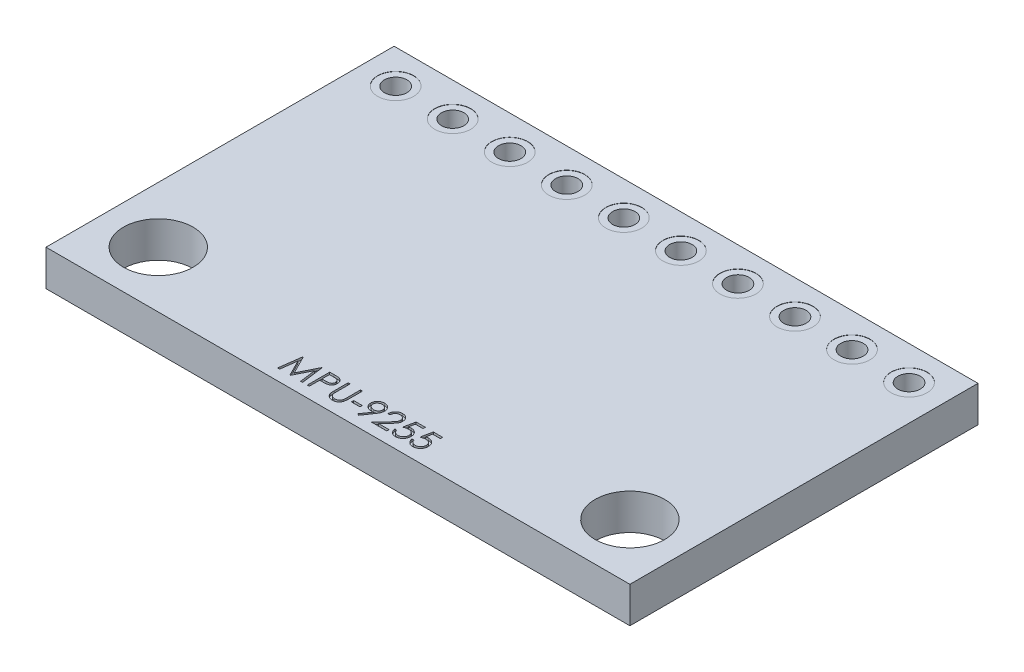
from build123d import *

# Parameters (mm, degrees)
BASES_W                   = 26
BASES_H                   = 15.5
BASE_DEPTH                = 0.8
HOLES_R                   = 0.5
HOLE_DEPTH                = 16.219149122
MOUNTINGHOLES_R           = 1.55
MOUNTINGHOLE_DEPTH        = 16.219149122
SOLDERINGCONNECTIONS_R    = 0.8
SOLDERINGCONNECTIONS_R_2  = 0.5
SOLDERINGCONNECTION_DEPTH = 0.01
SC_LP_COUNT               = 10
SC_LP_PITCH               = 2.54
SC_LP_COPY_1_SKETCH_R     = 0.8
SC_LP_COPY_1_SKETCH_R_2   = 0.5
SC_LP_COPY_1_DEPTH        = 0.01
SC_LP_COPY_2_SKETCH_R     = 0.8
SC_LP_COPY_2_SKETCH_R_2   = 0.5
SC_LP_COPY_2_DEPTH        = 0.01
SC_LP_COPY_3_SKETCH_R     = 0.8
SC_LP_COPY_3_SKETCH_R_2   = 0.5
SC_LP_COPY_3_DEPTH        = 0.01
SC_LP_COPY_4_SKETCH_R     = 0.8
SC_LP_COPY_4_SKETCH_R_2   = 0.5
SC_LP_COPY_4_DEPTH        = 0.01
SC_LP_COPY_5_SKETCH_R     = 0.8
SC_LP_COPY_5_SKETCH_R_2   = 0.5
SC_LP_COPY_5_DEPTH        = 0.01
SC_LP_COPY_6_SKETCH_R     = 0.8
SC_LP_COPY_6_SKETCH_R_2   = 0.5
SC_LP_COPY_6_DEPTH        = 0.01
SC_LP_COPY_7_SKETCH_R     = 0.8
SC_LP_COPY_7_SKETCH_R_2   = 0.5
SC_LP_COPY_7_DEPTH        = 0.01
SC_LP_COPY_8_SKETCH_R     = 0.8
SC_LP_COPY_8_SKETCH_R_2   = 0.5
SC_LP_COPY_8_DEPTH        = 0.01
SC_LP_COPY_9_SKETCH_R     = 0.8
SC_LP_COPY_9_SKETCH_R_2   = 0.5
SC_LP_COPY_9_DEPTH        = 0.01
PNSKETCH_W                = 0.384615384
PNSKETCH_H                = 0.102564103
PN_DEPTH                  = 0.1


with BuildPart() as part:
    # BaseS → Base (new, symmetric)
    with BuildSketch(Plane(origin=(0, 0, 0), x_dir=(1, 0, 0), z_dir=(0, 1, 0))):
        Rectangle(BASES_W, BASES_H)
    extrude(amount=BASE_DEPTH, both=True)

    # HoleS → Hole (cut, through all)
    with BuildSketch(Plane(origin=(0, 0.8, 0), x_dir=(1, 0, 0), z_dir=(0, 1, 0))):
        with Locations(Location((-11.43, 6.25, 0), (0, 0, 270))):
            Circle(HOLES_R)
        with Locations(Location((-8.89, 6.25, 0), (0, 0, 270))):
            Circle(HOLES_R)
        with Locations(Location((-6.35, 6.25, 0), (0, 0, 270))):
            Circle(HOLES_R)
        with Locations(Location((-3.81, 6.25, 0), (0, 0, 270))):
            Circle(HOLES_R)
        with Locations(Location((-1.27, 6.25, 0), (0, 0, 270))):
            Circle(HOLES_R)
        with Locations(Location((1.27, 6.25, 0), (0, 0, 270))):
            Circle(HOLES_R)
        with Locations(Location((3.81, 6.25, 0), (0, 0, 270))):
            Circle(HOLES_R)
        with Locations(Location((6.35, 6.25, 0), (0, 0, 270))):
            Circle(HOLES_R)
        with Locations(Location((8.89, 6.25, 0), (0, 0, 270))):
            Circle(HOLES_R)
        with Locations(Location((11.43, 6.25, 0), (0, 0, 270))):
            Circle(HOLES_R)
    extrude(amount=-HOLE_DEPTH, mode=Mode.SUBTRACT)

    # MountingHoleS → MountingHole (cut, through all)
    with BuildSketch(Plane(origin=(0, 0.8, 0), x_dir=(1, 0, 0), z_dir=(0, 1, 0))):
        with Locations(Location((-10.5, -5.25, 0), (0, 0, 270))):
            Circle(MOUNTINGHOLES_R)
    mountinghole = extrude(amount=-MOUNTINGHOLE_DEPTH, mode=Mode.SUBTRACT)

    # MH HM: MountingHole across plane
    add(mountinghole.mirror(Plane(origin=(0, 0, 0), x_dir=(0, 0, 1), z_dir=(1, 0, 0))), mode=Mode.SUBTRACT)

    # SolderingConnectionS → SolderingConnection (cut)
    with BuildSketch(Plane(origin=(0, 0.8, 0), x_dir=(1, 0, 0), z_dir=(0, 1, 0))):
        with Locations(Location((-11.43, 6.25, 0), (0, 0, 270))):
            Circle(SOLDERINGCONNECTIONS_R)
        with Locations(Location((-11.43, 6.25, 0), (0, 0, 270))):
            Circle(SOLDERINGCONNECTIONS_R_2, mode=Mode.SUBTRACT)
    solderingconnection = extrude(amount=-SOLDERINGCONNECTION_DEPTH, mode=Mode.SUBTRACT)

    # SC VM: SolderingConnection across plane
    add(solderingconnection.mirror(Plane.ZX), mode=Mode.SUBTRACT)

    # SC LP: SolderingConnection ×10
    with Locations(*[(i * SC_LP_PITCH, 0, 0) for i in range(1, SC_LP_COUNT)]):
        add(solderingconnection, mode=Mode.SUBTRACT)

    # SC LP copy 1 sketch → SC LP copy 1 (cut)
    with BuildSketch(Plane(origin=(2.54, -0.8, 0), x_dir=(1, 0, 0), z_dir=(0, -1, 0))):
        with Locations((-11.43, -6.25)):
            Circle(SC_LP_COPY_1_SKETCH_R)
        with Locations((-11.43, -6.25)):
            Circle(SC_LP_COPY_1_SKETCH_R_2, mode=Mode.SUBTRACT)
    extrude(amount=-SC_LP_COPY_1_DEPTH, mode=Mode.SUBTRACT)

    # SC LP copy 2 sketch → SC LP copy 2 (cut)
    with BuildSketch(Plane(origin=(5.08, -0.8, 0), x_dir=(1, 0, 0), z_dir=(0, -1, 0))):
        with Locations((-11.43, -6.25)):
            Circle(SC_LP_COPY_2_SKETCH_R)
        with Locations((-11.43, -6.25)):
            Circle(SC_LP_COPY_2_SKETCH_R_2, mode=Mode.SUBTRACT)
    extrude(amount=-SC_LP_COPY_2_DEPTH, mode=Mode.SUBTRACT)

    # SC LP copy 3 sketch → SC LP copy 3 (cut)
    with BuildSketch(Plane(origin=(7.62, -0.8, 0), x_dir=(1, 0, 0), z_dir=(0, -1, 0))):
        with Locations((-11.43, -6.25)):
            Circle(SC_LP_COPY_3_SKETCH_R)
        with Locations((-11.43, -6.25)):
            Circle(SC_LP_COPY_3_SKETCH_R_2, mode=Mode.SUBTRACT)
    extrude(amount=-SC_LP_COPY_3_DEPTH, mode=Mode.SUBTRACT)

    # SC LP copy 4 sketch → SC LP copy 4 (cut)
    with BuildSketch(Plane(origin=(10.16, -0.8, 0), x_dir=(1, 0, 0), z_dir=(0, -1, 0))):
        with Locations((-11.43, -6.25)):
            Circle(SC_LP_COPY_4_SKETCH_R)
        with Locations((-11.43, -6.25)):
            Circle(SC_LP_COPY_4_SKETCH_R_2, mode=Mode.SUBTRACT)
    extrude(amount=-SC_LP_COPY_4_DEPTH, mode=Mode.SUBTRACT)

    # SC LP copy 5 sketch → SC LP copy 5 (cut)
    with BuildSketch(Plane(origin=(12.7, -0.8, 0), x_dir=(1, 0, 0), z_dir=(0, -1, 0))):
        with Locations((-11.43, -6.25)):
            Circle(SC_LP_COPY_5_SKETCH_R)
        with Locations((-11.43, -6.25)):
            Circle(SC_LP_COPY_5_SKETCH_R_2, mode=Mode.SUBTRACT)
    extrude(amount=-SC_LP_COPY_5_DEPTH, mode=Mode.SUBTRACT)

    # SC LP copy 6 sketch → SC LP copy 6 (cut)
    with BuildSketch(Plane(origin=(15.24, -0.8, 0), x_dir=(1, 0, 0), z_dir=(0, -1, 0))):
        with Locations((-11.43, -6.25)):
            Circle(SC_LP_COPY_6_SKETCH_R)
        with Locations((-11.43, -6.25)):
            Circle(SC_LP_COPY_6_SKETCH_R_2, mode=Mode.SUBTRACT)
    extrude(amount=-SC_LP_COPY_6_DEPTH, mode=Mode.SUBTRACT)

    # SC LP copy 7 sketch → SC LP copy 7 (cut)
    with BuildSketch(Plane(origin=(17.78, -0.8, 0), x_dir=(1, 0, 0), z_dir=(0, -1, 0))):
        with Locations((-11.43, -6.25)):
            Circle(SC_LP_COPY_7_SKETCH_R)
        with Locations((-11.43, -6.25)):
            Circle(SC_LP_COPY_7_SKETCH_R_2, mode=Mode.SUBTRACT)
    extrude(amount=-SC_LP_COPY_7_DEPTH, mode=Mode.SUBTRACT)

    # SC LP copy 8 sketch → SC LP copy 8 (cut)
    with BuildSketch(Plane(origin=(20.32, -0.8, 0), x_dir=(1, 0, 0), z_dir=(0, -1, 0))):
        with Locations((-11.43, -6.25)):
            Circle(SC_LP_COPY_8_SKETCH_R)
        with Locations((-11.43, -6.25)):
            Circle(SC_LP_COPY_8_SKETCH_R_2, mode=Mode.SUBTRACT)
    extrude(amount=-SC_LP_COPY_8_DEPTH, mode=Mode.SUBTRACT)

    # SC LP copy 9 sketch → SC LP copy 9 (cut)
    with BuildSketch(Plane(origin=(22.86, -0.8, 0), x_dir=(1, 0, 0), z_dir=(0, -1, 0))):
        with Locations((-11.43, -6.25)):
            Circle(SC_LP_COPY_9_SKETCH_R)
        with Locations((-11.43, -6.25)):
            Circle(SC_LP_COPY_9_SKETCH_R_2, mode=Mode.SUBTRACT)
    extrude(amount=-SC_LP_COPY_9_DEPTH, mode=Mode.SUBTRACT)

    # PNSketch → PN (cut)
    # profile 1 of 8: a face of its own
    with BuildSketch(Plane(origin=(0, 0.8, 0), x_dir=(1, 0, 0), z_dir=(0, 1, 0))):
        Polygon((-3.185897436, -7.25), (-3.053886218, -6.25), (-3.041065705, -6.25), (-2.628205128, -7.070512821), (-2.216346154, -6.25), (-2.203325321, -6.25), (-2.070512821, -7.25), (-2.160657051, -7.25), (-2.256410256, -6.530448718), (-2.617387821, -7.25), (-2.637620192, -7.25), (-3, -6.528846154), (-3.095552885, -7.25), align=None)
    # profile 2 of 8: a face of its own
    with BuildSketch(Plane(origin=(0, 0.8, 0), x_dir=(1, 0, 0), z_dir=(0, 1, 0))):
        with BuildLine():
            Line((-1.865384615, -6.25), (-1.669270833, -6.25))
            add(Edge.make_bspline(
                [(-1.669270833, -6.25), (-1.655782003, -6.250014827), (-1.629936805, -6.250043238), (-1.592875361, -6.250904594), (-1.559215437, -6.252055077), (-1.529029614, -6.253649904), (-1.502225015, -6.255534644), (-1.478922929, -6.258178084), (-1.458940199, -6.260938168), (-1.446966927, -6.263744284), (-1.44150641, -6.265024038)],
                knots=[0, 0, 0, 0, 1.415646017, 2.712440637, 3.8905458, 4.950247383, 5.884950622, 6.709939814, 7.411656543, 8, 8, 8, 8], degree=3))
            add(Edge.make_bspline(
                [(-1.44150641, -6.265024038), (-1.434593972, -6.266916024), (-1.420931979, -6.270655413), (-1.401245966, -6.278145048), (-1.382516296, -6.287025667), (-1.364678708, -6.297146793), (-1.347952399, -6.308942668), (-1.332087815, -6.32193513), (-1.317224964, -6.33642415), (-1.303447423, -6.352247219), (-1.290794624, -6.369138707), (-1.279900429, -6.387350773), (-1.270778364, -6.406576859), (-1.262954572, -6.426803594), (-1.257323585, -6.448200829), (-1.253081614, -6.47061989), (-1.250389149, -6.494058373), (-1.250131274, -6.510075478), (-1.25, -6.518229167)],
                knots=[0, 0, 0, 0, 0.999701418, 1.975846123, 2.934577507, 3.890451536, 4.834027766, 5.787354733, 6.749476667, 7.726910423, 8.712836071, 9.690891519, 10.682875813, 11.679750201, 12.712814741, 13.765529915, 14.8625177, 16, 16, 16, 16], degree=3))
            add(Edge.make_bspline(
                [(-1.25, -6.518229167), (-1.250120407, -6.526451389), (-1.250355992, -6.542538721), (-1.253183502, -6.566073804), (-1.256992128, -6.588564772), (-1.262848429, -6.609961758), (-1.270518621, -6.630137692), (-1.27951635, -6.649400902), (-1.290368788, -6.667423665), (-1.302838739, -6.684271413), (-1.316710623, -6.699959959), (-1.331925748, -6.714375615), (-1.348422689, -6.727433997), (-1.366149017, -6.739164381), (-1.385277545, -6.749294747), (-1.40551816, -6.758368262), (-1.427046794, -6.765988565), (-1.441944655, -6.769997154), (-1.449519231, -6.772035256)],
                knots=[0, 0, 0, 0, 1.121902311, 2.195077645, 3.232258892, 4.234102512, 5.217864754, 6.176164875, 7.132989551, 8.084763148, 9.034132444, 9.988522005, 10.94243251, 11.903244335, 12.886203696, 13.894208494, 14.929344452, 16, 16, 16, 16], degree=3))
            add(Edge.make_bspline(
                [(-1.449519231, -6.772035256), (-1.455784183, -6.773367537), (-1.469514191, -6.776287306), (-1.492126397, -6.779546866), (-1.518453651, -6.782329037), (-1.548460016, -6.784415077), (-1.582118561, -6.786200896), (-1.619447491, -6.787620351), (-1.660520085, -6.78840031), (-1.689169012, -6.788440536), (-1.704126603, -6.788461538)],
                knots=[0, 0, 0, 0, 0.601384939, 1.31797006, 2.144135048, 3.087295005, 4.142315834, 5.309527816, 6.595305764, 8, 8, 8, 8], degree=3))
            Line((-1.704126603, -6.788461538), (-1.775641026, -6.788461538))
            Line((-1.775641026, -6.788461538), (-1.775641026, -7.25))
            Line((-1.775641026, -7.25), (-1.865384615, -7.25))
            Line((-1.865384615, -7.25), (-1.865384615, -6.25))
        make_face()
        with BuildLine():
            Line((-1.775641026, -6.352564103), (-1.775641026, -6.685897436))
            Line((-1.775641026, -6.685897436), (-1.600560897, -6.688100962))
            add(Edge.make_bspline(
                [(-1.600560897, -6.688100962), (-1.592012347, -6.68810538), (-1.575509547, -6.688113909), (-1.551670626, -6.686975274), (-1.529553687, -6.685660836), (-1.509226666, -6.683736286), (-1.490680399, -6.681015927), (-1.473883962, -6.678269716), (-1.458967595, -6.674296755), (-1.44151068, -6.668947307), (-1.422058295, -6.659823702), (-1.400896139, -6.646580877), (-1.382961685, -6.629700674), (-1.367442172, -6.610721294), (-1.355126207, -6.589607257), (-1.346110209, -6.567016132), (-1.340812736, -6.543179604), (-1.340102395, -6.526868707), (-1.33974359, -6.518629808)],
                knots=[0, 0, 0, 0, 1.160613943, 2.240541288, 3.23993089, 4.169200891, 5.011653406, 5.7853311, 6.478053781, 7.106038997, 8.262395093, 9.384106736, 10.481365981, 11.59014053, 12.70357646, 13.786202915, 14.881775077, 16, 16, 16, 16], degree=3))
            add(Edge.make_bspline(
                [(-1.33974359, -6.518629808), (-1.340104346, -6.510590232), (-1.340821484, -6.494608552), (-1.346151731, -6.471186049), (-1.355108678, -6.44883299), (-1.367524848, -6.427983537), (-1.382593742, -6.409072451), (-1.40010784, -6.3926447), (-1.420025915, -6.379438499), (-1.438553981, -6.370914704), (-1.455011462, -6.36571034), (-1.469306308, -6.362068957), (-1.485446501, -6.359161641), (-1.503437295, -6.356807497), (-1.523139248, -6.354792223), (-1.544721623, -6.353424801), (-1.568102664, -6.352624385), (-1.584334256, -6.352584683), (-1.592748397, -6.352564103)],
                knots=[0, 0, 0, 0, 1.120700087, 2.227813068, 3.331159281, 4.466773991, 5.599788987, 6.693661531, 7.80175334, 8.91857717, 9.525282508, 10.207424825, 10.974604443, 11.810962634, 12.737642355, 13.736264703, 14.826523623, 16, 16, 16, 16], degree=3))
            Line((-1.592748397, -6.352564103), (-1.775641026, -6.352564103))
        make_face(mode=Mode.SUBTRACT)
    # profile 3 of 8: a face of its own
    with BuildSketch(Plane(origin=(0, 0.8, 0), x_dir=(1, 0, 0), z_dir=(0, 1, 0))):
        with BuildLine():
            Line((-1.044871795, -6.25), (-0.955128205, -6.25))
            Line((-0.955128205, -6.25), (-0.955128205, -6.849158654))
            add(Edge.make_bspline(
                [(-0.955128205, -6.849158654), (-0.955141561, -6.857638864), (-0.955166905, -6.873731524), (-0.954997615, -6.896636753), (-0.95452351, -6.917000313), (-0.954224607, -6.934900698), (-0.953559655, -6.950255769), (-0.953017356, -6.963148714), (-0.952320054, -6.973518487), (-0.95148202, -6.97957018), (-0.951121795, -6.982171474)],
                knots=[0, 0, 0, 0, 1.528628734, 2.90083645, 4.128790002, 5.200304208, 6.127813768, 6.898992206, 7.526736466, 8, 8, 8, 8], degree=3))
            add(Edge.make_bspline(
                [(-0.951121795, -6.982171474), (-0.949642521, -6.991556264), (-0.946767325, -7.009797044), (-0.939439788, -7.035770838), (-0.929206217, -7.059179827), (-0.917079633, -7.080754481), (-0.901098887, -7.099894298), (-0.88195502, -7.117526199), (-0.858761371, -7.132946715), (-0.832972627, -7.147046947), (-0.805176845, -7.158379827), (-0.776773626, -7.16694936), (-0.748189918, -7.172171903), (-0.72905387, -7.172776628), (-0.719551282, -7.173076923)],
                knots=[0, 0, 0, 0, 1.035780045, 2.013197591, 2.933192213, 3.817615948, 4.702609284, 5.640816605, 6.646850145, 7.73207398, 8.84249596, 9.914020372, 10.964143139, 12, 12, 12, 12], degree=3))
            add(Edge.make_bspline(
                [(-0.719551282, -7.173076923), (-0.711393071, -7.172770109), (-0.695123767, -7.172158252), (-0.670950501, -7.168369272), (-0.647407613, -7.161540539), (-0.624378847, -7.152729179), (-0.602792852, -7.14108701), (-0.582637583, -7.127638199), (-0.564647887, -7.111863663), (-0.548231316, -7.094406422), (-0.53393562, -7.074709336), (-0.521543866, -7.053201297), (-0.5113936, -7.029558626), (-0.506381164, -7.012943077), (-0.50380609, -7.004407051)],
                knots=[0, 0, 0, 0, 0.994687771, 1.983630487, 2.973142513, 3.978332533, 4.983357753, 5.956394766, 6.925816176, 7.893390482, 8.871859704, 9.88551698, 10.913711441, 12, 12, 12, 12], degree=3))
            add(Edge.make_bspline(
                [(-0.50380609, -7.004407051), (-0.502948911, -7.000878887), (-0.501038772, -6.993016716), (-0.499253902, -6.979724918), (-0.497394894, -6.964042243), (-0.496105017, -6.945856011), (-0.494847526, -6.925227161), (-0.494095219, -6.902048231), (-0.493747495, -6.876403385), (-0.493643872, -6.858507053), (-0.493589744, -6.849158654)],
                knots=[0, 0, 0, 0, 0.558680831, 1.244966039, 2.062412453, 2.990489873, 4.051219941, 5.244515665, 6.560634259, 8, 8, 8, 8], degree=3))
            Line((-0.493589744, -6.849158654), (-0.493589744, -6.25))
            Line((-0.493589744, -6.25), (-0.403846154, -6.25))
            Line((-0.403846154, -6.25), (-0.403846154, -6.853966346))
            add(Edge.make_bspline(
                [(-0.403846154, -6.853966346), (-0.40391876, -6.864851597), (-0.404060454, -6.886094827), (-0.40528919, -6.917223786), (-0.407248333, -6.94675321), (-0.410016358, -6.974687066), (-0.413684074, -7.000925397), (-0.417762708, -7.025698188), (-0.42295686, -7.048827614), (-0.429023546, -7.070494019), (-0.435958846, -7.091118452), (-0.444942031, -7.110692342), (-0.455063317, -7.129810742), (-0.467067503, -7.148184487), (-0.48055647, -7.165894931), (-0.495828379, -7.182834666), (-0.512378139, -7.199274394), (-0.53048087, -7.214792413), (-0.549838163, -7.229023463), (-0.570392437, -7.241537112), (-0.591985799, -7.252115289), (-0.614562121, -7.260822696), (-0.638131036, -7.267369724), (-0.662693139, -7.27224834), (-0.688304337, -7.275020425), (-0.70572281, -7.275432405), (-0.714543269, -7.275641026)],
                knots=[0, 0, 0, 0, 1.316592851, 2.569410997, 3.76748051, 4.895814652, 5.963796859, 6.97159953, 7.931736103, 8.829262218, 9.692595152, 10.560224239, 11.431080259, 12.30701507, 13.211635791, 14.121146779, 15.063487852, 16.031507147, 17.00238618, 17.966455255, 18.938106653, 19.907068911, 20.888905087, 21.893141452, 22.933117798, 24, 24, 24, 24], degree=3))
            add(Edge.make_bspline(
                [(-0.714543269, -7.275641026), (-0.724163013, -7.275416807), (-0.743036915, -7.274976891), (-0.770847792, -7.272456105), (-0.797508991, -7.267707992), (-0.823302098, -7.261662294), (-0.847875955, -7.253324084), (-0.871559796, -7.243581762), (-0.893947991, -7.231616831), (-0.915403742, -7.218304433), (-0.935353672, -7.203325965), (-0.953667216, -7.187000201), (-0.970374607, -7.169588664), (-0.985194235, -7.150902845), (-0.99837163, -7.131088072), (-1.00972312, -7.110088289), (-1.019469761, -7.087911627), (-1.024500209, -7.072496427), (-1.027043269, -7.064703526)],
                knots=[0, 0, 0, 0, 1.13879206, 2.234305948, 3.301075583, 4.341971843, 5.366689343, 6.369221514, 7.369726634, 8.367512178, 9.355451585, 10.318319045, 11.268648973, 12.207971039, 13.137398894, 14.081662264, 15.030215811, 16, 16, 16, 16], degree=3))
            add(Edge.make_bspline(
                [(-1.027043269, -7.064703526), (-1.028522457, -7.059379933), (-1.031730849, -7.047832942), (-1.035166648, -7.028722517), (-1.038054957, -7.006718254), (-1.040770831, -6.981818649), (-1.042373391, -6.954004401), (-1.043778373, -6.923287568), (-1.044881693, -6.889631008), (-1.044875186, -6.866186861), (-1.044871795, -6.853966346)],
                knots=[0, 0, 0, 0, 0.625038921, 1.35572334, 2.194682327, 3.136881307, 4.189498639, 5.346923369, 6.617055217, 8, 8, 8, 8], degree=3))
            Line((-1.044871795, -6.853966346), (-1.044871795, -6.25))
        make_face()
    # profile 4 of 8: a face of its own
    with BuildSketch(Plane(origin=(0, 0.8, 0), x_dir=(1, 0, 0), z_dir=(0, 1, 0))):
        with Locations((-0.044871795, -6.865384616)):
            Rectangle(PNSKETCH_W, PNSKETCH_H)
    # profile 5 of 8: a face of its own
    with BuildSketch(Plane(origin=(0, 0.8, 0), x_dir=(1, 0, 0), z_dir=(0, 1, 0))):
        with BuildLine():
            Line((0.442307692, -7.275641026), (0.370592949, -7.225761218))
            Line((0.370592949, -7.225761218), (0.648637821, -6.819310897))
            add(Edge.make_bspline(
                [(0.648637821, -6.819310897), (0.63089761, -6.821480344), (0.595966147, -6.825752106), (0.560784118, -6.826536864), (0.543469551, -6.826923077)],
                knots=[0, 0, 0, 0, 1.015715272, 2, 2, 2, 2], degree=3))
            add(Edge.make_bspline(
                [(0.543469551, -6.826923077), (0.532971823, -6.826654198), (0.512365701, -6.826126412), (0.482070944, -6.821943038), (0.452960783, -6.815500145), (0.425112396, -6.805886215), (0.398421109, -6.793938155), (0.372945191, -6.779121865), (0.348718936, -6.761691496), (0.326002533, -6.741739213), (0.305342037, -6.719831198), (0.28693538, -6.696643871), (0.271637914, -6.67190788), (0.258930318, -6.646127817), (0.249293046, -6.618933145), (0.242275178, -6.590633317), (0.237954505, -6.56102999), (0.237440478, -6.540879953), (0.237179487, -6.530649038)],
                knots=[0, 0, 0, 0, 1.060718605, 2.082097864, 3.085795603, 4.069760067, 5.054557537, 6.03741023, 7.043284206, 8.066802108, 9.088538119, 10.083643548, 11.053783639, 12.022749082, 12.983451788, 13.964007469, 14.966251758, 16, 16, 16, 16], degree=3))
            add(Edge.make_bspline(
                [(0.237179487, -6.530649038), (0.23767504, -6.516657995), (0.23864771, -6.489196414), (0.246475857, -6.44907248), (0.25935024, -6.411133468), (0.277301205, -6.375479127), (0.299911125, -6.342622344), (0.327085008, -6.313019884), (0.358657569, -6.287092783), (0.393909575, -6.264805904), (0.432010438, -6.246881619), (0.471915769, -6.23367039), (0.513319803, -6.22589932), (0.541367709, -6.224874788), (0.555488782, -6.224358974)],
                knots=[0, 0, 0, 0, 1.022988612, 2.007919123, 2.978103895, 3.94594894, 4.918897164, 5.887013414, 6.875921846, 7.89917871, 8.930658928, 9.948724884, 10.967259574, 12, 12, 12, 12], degree=3))
            add(Edge.make_bspline(
                [(0.555488782, -6.224358974), (0.569342616, -6.224881878), (0.596716487, -6.225915087), (0.636970489, -6.233481935), (0.675525065, -6.24623527), (0.71216649, -6.263859431), (0.746092036, -6.285951119), (0.776599411, -6.312275269), (0.802992422, -6.342848276), (0.825227816, -6.376930702), (0.843076399, -6.41354984), (0.855954194, -6.451773817), (0.86388152, -6.491327738), (0.86488047, -6.518126159), (0.865384615, -6.531650641)],
                knots=[0, 0, 0, 0, 1.026385292, 2.028040595, 3.023318987, 4.028184125, 5.03290303, 6.015178782, 7.004435299, 8.016004309, 9.023023918, 10.015172535, 10.998308025, 12, 12, 12, 12], degree=3))
            add(Edge.make_bspline(
                [(0.865384615, -6.531650641), (0.865047927, -6.54214886), (0.864365039, -6.563441872), (0.859583237, -6.595793398), (0.851463184, -6.628779464), (0.842248413, -6.65669992), (0.833353508, -6.679759477), (0.824981756, -6.697974214), (0.81569257, -6.717146004), (0.804858637, -6.737073814), (0.793212266, -6.758011682), (0.780052473, -6.7797496), (0.765679452, -6.802316741), (0.755442389, -6.817530195), (0.750200321, -6.825320513)],
                knots=[0, 0, 0, 0, 1.179839688, 2.393009684, 3.667231171, 4.993948276, 5.694988576, 6.444077775, 7.246288328, 8.089075292, 8.993003841, 9.939041771, 10.944649915, 12, 12, 12, 12], degree=3))
            Line((0.750200321, -6.825320513), (0.442307692, -7.275641026))
        make_face()
        with BuildLine():
            add(Edge.make_bspline(
                [(0.560096154, -6.724358974), (0.568048729, -6.724141722), (0.58352969, -6.723718805), (0.606208918, -6.721144736), (0.627615834, -6.71658074), (0.647807619, -6.710032251), (0.666986734, -6.702130345), (0.684848542, -6.692069778), (0.701407992, -6.680065025), (0.716775971, -6.666576449), (0.730422828, -6.651590568), (0.74257798, -6.635905681), (0.752909571, -6.619452935), (0.761070507, -6.602026288), (0.767780386, -6.584049943), (0.772414103, -6.565234413), (0.774981056, -6.545677727), (0.775418649, -6.532392396), (0.775641026, -6.525641026)],
                knots=[0, 0, 0, 0, 1.163407946, 2.26475976, 3.333800367, 4.359385343, 5.366239384, 6.363380779, 7.350133999, 8.353570782, 9.349036268, 10.310270964, 11.253520213, 12.184142, 13.120487599, 14.056272588, 15.012232024, 16, 16, 16, 16], degree=3))
            add(Edge.make_bspline(
                [(0.775641026, -6.525641026), (0.775449692, -6.518886836), (0.775072644, -6.505576876), (0.772047702, -6.485991236), (0.766726209, -6.467221733), (0.759586071, -6.44916561), (0.750180289, -6.431971218), (0.738893578, -6.415422683), (0.725484307, -6.399624932), (0.710055002, -6.384949508), (0.693416559, -6.371421537), (0.675684987, -6.359482658), (0.65700644, -6.349476602), (0.637494871, -6.341219754), (0.617109629, -6.334776389), (0.595862775, -6.330142856), (0.573646945, -6.327579498), (0.558566577, -6.327144671), (0.55088141, -6.326923077)],
                knots=[0, 0, 0, 0, 0.972161553, 1.915763587, 2.844109794, 3.775983486, 4.705125789, 5.659731448, 6.655561913, 7.682237399, 8.721216875, 9.739758359, 10.754845918, 11.767244016, 12.7857855, 13.828538656, 14.893392813, 16, 16, 16, 16], degree=3))
            add(Edge.make_bspline(
                [(0.55088141, -6.326923077), (0.543263081, -6.327145029), (0.528315981, -6.327580497), (0.50629765, -6.330137984), (0.485194459, -6.334807551), (0.464868282, -6.341216769), (0.445357293, -6.349477218), (0.426679626, -6.359483182), (0.408943907, -6.371418789), (0.392321416, -6.384960152), (0.376864867, -6.399556623), (0.363686144, -6.415491888), (0.352373603, -6.431962609), (0.342980745, -6.449167897), (0.335837169, -6.467221122), (0.330516597, -6.485991401), (0.327491407, -6.505576832), (0.327114394, -6.518886821), (0.326923077, -6.525641026)],
                knots=[0, 0, 0, 0, 1.099389452, 2.15699305, 3.192601482, 4.213358962, 5.227959689, 6.245255729, 7.266013209, 8.307253147, 9.336162325, 10.327954924, 11.284637477, 12.215801273, 13.149702402, 14.080068371, 15.025723358, 16, 16, 16, 16], degree=3))
            add(Edge.make_bspline(
                [(0.326923077, -6.525641026), (0.327096199, -6.532397654), (0.327437626, -6.545722961), (0.330731281, -6.565301931), (0.336239361, -6.584069986), (0.343616329, -6.602209617), (0.353331069, -6.619544433), (0.365252169, -6.635992251), (0.379225182, -6.651739523), (0.395063321, -6.666541583), (0.412397082, -6.680127919), (0.430910438, -6.691993742), (0.450284677, -6.702014441), (0.470588, -6.710054836), (0.491669943, -6.716515311), (0.51371998, -6.721136324), (0.536665191, -6.723694115), (0.5522109, -6.724135228), (0.560096154, -6.724358974)],
                knots=[0, 0, 0, 0, 0.952633368, 1.87876736, 2.791047057, 3.707742249, 4.635551637, 5.587206343, 6.568248508, 7.601284464, 8.641511608, 9.671105535, 10.699146789, 11.713763218, 12.747829548, 13.806491675, 14.887386225, 16, 16, 16, 16], degree=3))
        make_face(mode=Mode.SUBTRACT)
    # profile 6 of 8: a face of its own
    with BuildSketch(Plane(origin=(0, 0.8, 0), x_dir=(1, 0, 0), z_dir=(0, 1, 0))):
        with BuildLine():
            Line((1.121794872, -6.557692308), (1.032051282, -6.557692308))
            add(Edge.make_bspline(
                [(1.032051282, -6.557692308), (1.032636183, -6.54578634), (1.033784913, -6.522403336), (1.039164424, -6.488310791), (1.046861817, -6.455723706), (1.05774509, -6.42490373), (1.071261169, -6.395578357), (1.087469749, -6.367864066), (1.106667992, -6.341866584), (1.128441344, -6.317826914), (1.152089527, -6.295773323), (1.177605509, -6.276728968), (1.204418374, -6.260638204), (1.232446774, -6.247186421), (1.262006935, -6.237089322), (1.292830609, -6.229597425), (1.325053219, -6.225089898), (1.347007511, -6.224605388), (1.358173077, -6.224358974)],
                knots=[0, 0, 0, 0, 1.10065271, 2.161652631, 3.183658789, 4.190468796, 5.17591951, 6.163126047, 7.15150782, 8.156236427, 9.156009102, 10.134482811, 11.092018607, 12.041330605, 13.001268258, 13.972401359, 14.968799086, 16, 16, 16, 16], degree=3))
            add(Edge.make_bspline(
                [(1.358173077, -6.224358974), (1.369138241, -6.224615676), (1.390684397, -6.225120086), (1.422130686, -6.229451809), (1.452067056, -6.236236264), (1.48043499, -6.245754954), (1.507008151, -6.258550505), (1.531986164, -6.27392123), (1.555666395, -6.291698325), (1.576982619, -6.312627986), (1.596556356, -6.334971524), (1.613442715, -6.358825211), (1.627903619, -6.38346215), (1.639957241, -6.409070207), (1.648830424, -6.435890501), (1.655567055, -6.463532559), (1.659374887, -6.492282505), (1.659959294, -6.511741521), (1.66025641, -6.521634615)],
                knots=[0, 0, 0, 0, 1.111607364, 2.184268762, 3.212621178, 4.221274766, 5.211760367, 6.196651075, 7.1921475, 8.207485113, 9.220403448, 10.201281604, 11.166441695, 12.114753415, 13.065576456, 14.026450734, 14.996634279, 16, 16, 16, 16], degree=3))
            add(Edge.make_bspline(
                [(1.66025641, -6.521634615), (1.659772621, -6.535562568), (1.658813532, -6.563174058), (1.650609424, -6.603749733), (1.637796135, -6.643062138), (1.622368319, -6.674701367), (1.606804764, -6.700196651), (1.592779762, -6.72118771), (1.576361244, -6.743789272), (1.557310245, -6.767925654), (1.536020853, -6.793785913), (1.512300235, -6.821354426), (1.48597924, -6.85034636), (1.467505382, -6.870147961), (1.457932692, -6.880408654)],
                knots=[0, 0, 0, 0, 1.184426356, 2.348067706, 3.509069118, 4.696110526, 5.333549288, 6.050745305, 6.844228056, 7.710549037, 8.667450064, 9.695053472, 10.805634456, 12, 12, 12, 12], degree=3))
            Line((1.457932692, -6.880408654), (1.207732372, -7.147435897))
            Line((1.207732372, -7.147435897), (1.673076923, -7.147435897))
            Line((1.673076923, -7.147435897), (1.673076923, -7.25))
            Line((1.673076923, -7.25), (0.993589744, -7.25))
            Line((0.993589744, -7.25), (1.381410256, -6.836137821))
            add(Edge.make_bspline(
                [(1.381410256, -6.836137821), (1.39085251, -6.826281161), (1.408989146, -6.807348537), (1.434641311, -6.779707691), (1.457681022, -6.754064965), (1.47825742, -6.730468808), (1.495924136, -6.708574075), (1.511601916, -6.689089874), (1.524163514, -6.671160031), (1.537796484, -6.650376998), (1.551000478, -6.62500205), (1.562346866, -6.593992425), (1.569265394, -6.562070353), (1.570095347, -6.540498342), (1.570512821, -6.529647436)],
                knots=[0, 0, 0, 0, 1.329631726, 2.553950428, 3.673215718, 4.687767853, 5.603093632, 6.413772471, 7.123043292, 7.734684054, 8.834405432, 9.900288307, 10.943827018, 12, 12, 12, 12], degree=3))
            add(Edge.make_bspline(
                [(1.570512821, -6.529647436), (1.57033118, -6.522824179), (1.569973201, -6.509376851), (1.566813859, -6.489660919), (1.562039429, -6.470642401), (1.555197926, -6.452262796), (1.546167429, -6.434706895), (1.535175035, -6.417953329), (1.52249216, -6.401756482), (1.507820368, -6.386569826), (1.491702791, -6.37266091), (1.474675863, -6.360339742), (1.456661547, -6.350042854), (1.437735798, -6.341601854), (1.417951378, -6.334980317), (1.397270023, -6.330392151), (1.375748875, -6.327511442), (1.361053591, -6.327121678), (1.353565705, -6.326923077)],
                knots=[0, 0, 0, 0, 0.991446411, 1.95395049, 2.89581595, 3.838931463, 4.798493298, 5.75982156, 6.748411868, 7.785213223, 8.824556874, 9.840280684, 10.836137867, 11.835679398, 12.848801643, 13.863922112, 14.911575587, 16, 16, 16, 16], degree=3))
            add(Edge.make_bspline(
                [(1.353565705, -6.326923077), (1.345745467, -6.327127372), (1.330387811, -6.327528573), (1.307839516, -6.330335049), (1.286329294, -6.335176717), (1.265803036, -6.341798624), (1.246226011, -6.350215353), (1.227693427, -6.360698708), (1.210246888, -6.373208278), (1.193853595, -6.387391294), (1.178749601, -6.403182037), (1.165479065, -6.420784884), (1.153883633, -6.439878431), (1.143766709, -6.46041116), (1.135550797, -6.482569383), (1.129272754, -6.506274441), (1.124305084, -6.531423407), (1.122645506, -6.548790574), (1.121794872, -6.557692308)],
                knots=[0, 0, 0, 0, 1.031018746, 2.02475058, 2.990194455, 3.934040569, 4.864654155, 5.795059489, 6.735614925, 7.690564532, 8.649604399, 9.611025574, 10.590972636, 11.591080095, 12.624614302, 13.701020113, 14.821632451, 16, 16, 16, 16], degree=3))
        make_face()
    # profile 7 of 8: a face of its own
    with BuildSketch(Plane(origin=(0, 0.8, 0), x_dir=(1, 0, 0), z_dir=(0, 1, 0))):
        with BuildLine():
            Line((2.391025641, -6.25), (2.391025641, -6.352564103))
            Line((2.391025641, -6.352564103), (2.05088141, -6.352564103))
            Line((2.05088141, -6.352564103), (1.996995192, -6.615584936))
            add(Edge.make_bspline(
                [(1.996995192, -6.615584936), (2.007582585, -6.612662001), (2.028093984, -6.606999277), (2.05836823, -6.600711914), (2.087108859, -6.596921787), (2.105758965, -6.59640427), (2.114783654, -6.596153846)],
                knots=[0, 0, 0, 0, 1.100273476, 2.13160584, 3.095893838, 4, 4, 4, 4], degree=3))
            add(Edge.make_bspline(
                [(2.114783654, -6.596153846), (2.125950437, -6.596395542), (2.147907122, -6.596870777), (2.180032535, -6.601434162), (2.210699076, -6.608616995), (2.23984261, -6.61865143), (2.267517053, -6.631482782), (2.293467785, -6.647511336), (2.318084332, -6.666235145), (2.340925073, -6.687762292), (2.361646304, -6.711454182), (2.379865158, -6.73692786), (2.395340184, -6.763935763), (2.407786114, -6.792735937), (2.417724495, -6.823009981), (2.424339351, -6.855076433), (2.428744125, -6.888633039), (2.429236235, -6.911577202), (2.429487179, -6.923277244)],
                knots=[0, 0, 0, 0, 1.052922333, 2.070308379, 3.05430497, 4.020497103, 4.973039431, 5.925935799, 6.892292201, 7.88610001, 8.88166317, 9.857072816, 10.836096531, 11.812156883, 12.81219415, 13.836441305, 14.89672472, 16, 16, 16, 16], degree=3))
            add(Edge.make_bspline(
                [(2.429487179, -6.923277244), (2.429297158, -6.931426449), (2.428919683, -6.947614732), (2.427000086, -6.971655932), (2.423304168, -6.99518817), (2.418341961, -7.018214567), (2.41190127, -7.040691531), (2.404104397, -7.062683396), (2.394562675, -7.084053284), (2.384096568, -7.105003397), (2.37231186, -7.125060113), (2.359232286, -7.143816966), (2.345413575, -7.161555332), (2.330544607, -7.17808497), (2.31448718, -7.193297261), (2.297435761, -7.207282484), (2.279526413, -7.22027715), (2.260482058, -7.231753777), (2.240727063, -7.242314622), (2.219976144, -7.25097849), (2.198701658, -7.258724355), (2.176597408, -7.264898506), (2.153713461, -7.269736379), (2.130012097, -7.273022264), (2.105617619, -7.275415532), (2.089081902, -7.275565349), (2.080729167, -7.275641026)],
                knots=[0, 0, 0, 0, 1.056347294, 2.098418968, 3.122841568, 4.141288669, 5.149314143, 6.15115421, 7.162517403, 8.180376062, 9.185164535, 10.17417709, 11.141909838, 12.097768115, 13.052685741, 14.0056014, 14.954263652, 15.917497458, 16.885230207, 17.854509472, 18.828990115, 19.81800267, 20.826176721, 21.857883937, 22.917946725, 24, 24, 24, 24], degree=3))
            add(Edge.make_bspline(
                [(2.080729167, -7.275641026), (2.070765115, -7.275443643), (2.051162021, -7.275055317), (2.022441859, -7.270992893), (1.994809114, -7.265174631), (1.968486228, -7.256421411), (1.943237296, -7.245453612), (1.919402233, -7.231591849), (1.896372012, -7.215883534), (1.875082858, -7.19734629), (1.855323969, -7.177084667), (1.837636395, -7.155096769), (1.821883944, -7.1317455), (1.808318874, -7.106917456), (1.79674801, -7.080677876), (1.787658014, -7.052928447), (1.780321341, -7.02381416), (1.777217506, -7.0037703), (1.775641026, -6.993589744)],
                knots=[0, 0, 0, 0, 1.0467383, 2.05933395, 3.04377827, 4.011590433, 4.970194871, 5.932262533, 6.905835911, 7.896367577, 8.894135286, 9.877477877, 10.858688626, 11.851381753, 12.8477658, 13.868841284, 14.917554742, 16, 16, 16, 16], degree=3))
            Line((1.775641026, -6.993589744), (1.865384615, -6.993589744))
            add(Edge.make_bspline(
                [(1.865384615, -6.993589744), (1.867592775, -7.003125873), (1.871836979, -7.021454843), (1.881152908, -7.047206655), (1.892543158, -7.070155004), (1.906087257, -7.090603457), (1.922244409, -7.108434599), (1.940681388, -7.124325188), (1.961352167, -7.138660939), (1.984321661, -7.150610301), (2.008553969, -7.160801374), (2.033916029, -7.167587572), (2.059717271, -7.172359256), (2.077168234, -7.172836902), (2.0859375, -7.173076923)],
                knots=[0, 0, 0, 0, 1.136247022, 2.183929868, 3.172523383, 4.106158343, 5.02341133, 5.958108904, 6.928429099, 7.938127109, 8.96079061, 9.975095812, 10.982467395, 12, 12, 12, 12], degree=3))
            add(Edge.make_bspline(
                [(2.0859375, -7.173076923), (2.094497056, -7.172842415), (2.11135089, -7.172380667), (2.136154144, -7.168826664), (2.160100679, -7.163353072), (2.18295421, -7.155161685), (2.20511465, -7.145206051), (2.226021441, -7.132430315), (2.246279406, -7.117727452), (2.265258873, -7.100882701), (2.282641573, -7.082319931), (2.298000464, -7.062469247), (2.310793868, -7.041293005), (2.321575042, -7.019157819), (2.329761699, -6.995821088), (2.335601979, -6.971392181), (2.339031425, -6.945810758), (2.33950319, -6.928362384), (2.33974359, -6.919471154)],
                knots=[0, 0, 0, 0, 1.027316725, 2.022795036, 3.002884548, 3.971462791, 4.93288096, 5.914575861, 6.907176829, 7.935150275, 8.956128384, 9.956726525, 10.942570165, 11.921478529, 12.907843606, 13.90538589, 14.932640048, 16, 16, 16, 16], degree=3))
            add(Edge.make_bspline(
                [(2.33974359, -6.919471154), (2.339555453, -6.911449511), (2.339187201, -6.895748285), (2.336178467, -6.872777083), (2.330945046, -6.851041928), (2.323681081, -6.830437861), (2.314458364, -6.810945449), (2.303187989, -6.792544575), (2.289658447, -6.775477766), (2.274203622, -6.759737036), (2.257272753, -6.745209929), (2.238574541, -6.732825904), (2.218500276, -6.722407642), (2.197291819, -6.713416785), (2.174444705, -6.706959429), (2.150411381, -6.702111462), (2.124932322, -6.699307073), (2.107512125, -6.698917962), (2.098557692, -6.698717949)],
                knots=[0, 0, 0, 0, 1.045622112, 2.046656509, 3.013763289, 3.955457236, 4.890082067, 5.820317437, 6.762574623, 7.722996705, 8.69280354, 9.665887285, 10.63943826, 11.638615906, 12.663482002, 13.728887084, 14.832589034, 16, 16, 16, 16], degree=3))
            add(Edge.make_bspline(
                [(2.098557692, -6.698717949), (2.09080657, -6.698883832), (2.074802468, -6.699226339), (2.050253089, -6.701748195), (2.024455454, -6.705816565), (1.997508455, -6.711412635), (1.969331167, -6.7187358), (1.939983053, -6.727511372), (1.909402405, -6.738003371), (1.888797341, -6.745926861), (1.878205128, -6.75)],
                knots=[0, 0, 0, 0, 0.817624296, 1.688186739, 2.600797293, 3.572016777, 4.590301741, 5.671205678, 6.80286297, 8, 8, 8, 8], degree=3))
            Line((1.878205128, -6.75), (1.980769231, -6.25))
            Line((1.980769231, -6.25), (2.391025641, -6.25))
        make_face()
    # profile 8 of 8: a face of its own
    with BuildSketch(Plane(origin=(0, 0.8, 0), x_dir=(1, 0, 0), z_dir=(0, 1, 0))):
        with BuildLine():
            Line((3.16025641, -6.25), (3.16025641, -6.352564103))
            Line((3.16025641, -6.352564103), (2.820112179, -6.352564103))
            Line((2.820112179, -6.352564103), (2.766225962, -6.615584936))
            add(Edge.make_bspline(
                [(2.766225962, -6.615584936), (2.776813354, -6.612662001), (2.797324753, -6.606999277), (2.827598999, -6.600711914), (2.856339629, -6.596921787), (2.874989734, -6.59640427), (2.884014423, -6.596153846)],
                knots=[0, 0, 0, 0, 1.100273476, 2.13160584, 3.095893838, 4, 4, 4, 4], degree=3))
            add(Edge.make_bspline(
                [(2.884014423, -6.596153846), (2.895181206, -6.596395542), (2.917137891, -6.596870777), (2.949263304, -6.601434162), (2.979929845, -6.608616995), (3.009073379, -6.61865143), (3.036747823, -6.631482782), (3.062698554, -6.647511336), (3.087315101, -6.666235145), (3.110155842, -6.687762292), (3.130877073, -6.711454182), (3.149095927, -6.73692786), (3.164570953, -6.763935763), (3.177016883, -6.792735937), (3.186955264, -6.823009981), (3.19357012, -6.855076433), (3.197974894, -6.888633039), (3.198467004, -6.911577202), (3.198717949, -6.923277244)],
                knots=[0, 0, 0, 0, 1.052922333, 2.070308379, 3.05430497, 4.020497103, 4.973039431, 5.925935799, 6.892292201, 7.88610001, 8.88166317, 9.857072816, 10.836096531, 11.812156883, 12.81219415, 13.836441305, 14.89672472, 16, 16, 16, 16], degree=3))
            add(Edge.make_bspline(
                [(3.198717949, -6.923277244), (3.198527927, -6.931426449), (3.198150452, -6.947614732), (3.196230856, -6.971655932), (3.192534937, -6.99518817), (3.18757273, -7.018214567), (3.181132039, -7.040691531), (3.173335167, -7.062683396), (3.163793444, -7.084053284), (3.153327337, -7.105003397), (3.141542629, -7.125060113), (3.128463056, -7.143816966), (3.114644344, -7.161555332), (3.099775377, -7.17808497), (3.083717949, -7.193297261), (3.06666653, -7.207282484), (3.048757182, -7.22027715), (3.029712827, -7.231753777), (3.009957832, -7.242314622), (2.989206913, -7.25097849), (2.967932427, -7.258724355), (2.945828177, -7.264898506), (2.92294423, -7.269736379), (2.899242866, -7.273022264), (2.874848389, -7.275415532), (2.858312671, -7.275565349), (2.849959936, -7.275641026)],
                knots=[0, 0, 0, 0, 1.056347294, 2.098418968, 3.122841568, 4.141288669, 5.149314143, 6.15115421, 7.162517403, 8.180376062, 9.185164535, 10.17417709, 11.141909838, 12.097768115, 13.052685741, 14.0056014, 14.954263652, 15.917497458, 16.885230207, 17.854509472, 18.828990115, 19.81800267, 20.826176721, 21.857883937, 22.917946725, 24, 24, 24, 24], degree=3))
            add(Edge.make_bspline(
                [(2.849959936, -7.275641026), (2.839995884, -7.275443643), (2.82039279, -7.275055317), (2.791672628, -7.270992893), (2.764039883, -7.265174631), (2.737716997, -7.256421411), (2.712468065, -7.245453612), (2.688633003, -7.231591849), (2.665602781, -7.215883534), (2.644313627, -7.19734629), (2.624554738, -7.177084667), (2.606867164, -7.155096769), (2.591114713, -7.1317455), (2.577549643, -7.106917456), (2.56597878, -7.080677876), (2.556888783, -7.052928447), (2.54955211, -7.02381416), (2.546448276, -7.0037703), (2.544871795, -6.993589744)],
                knots=[0, 0, 0, 0, 1.0467383, 2.05933395, 3.04377827, 4.011590433, 4.970194871, 5.932262533, 6.905835911, 7.896367577, 8.894135286, 9.877477877, 10.858688626, 11.851381753, 12.8477658, 13.868841284, 14.917554742, 16, 16, 16, 16], degree=3))
            Line((2.544871795, -6.993589744), (2.634615385, -6.993589744))
            add(Edge.make_bspline(
                [(2.634615385, -6.993589744), (2.636823544, -7.003125873), (2.641067749, -7.021454843), (2.650383677, -7.047206655), (2.661773927, -7.070155004), (2.675318026, -7.090603457), (2.691475178, -7.108434599), (2.709912158, -7.124325188), (2.730582936, -7.138660939), (2.75355243, -7.150610301), (2.777784738, -7.160801374), (2.803146798, -7.167587572), (2.82894804, -7.172359256), (2.846399003, -7.172836902), (2.855168269, -7.173076923)],
                knots=[0, 0, 0, 0, 1.136247022, 2.183929868, 3.172523383, 4.106158343, 5.02341133, 5.958108904, 6.928429099, 7.938127109, 8.96079061, 9.975095812, 10.982467395, 12, 12, 12, 12], degree=3))
            add(Edge.make_bspline(
                [(2.855168269, -7.173076923), (2.863727825, -7.172842415), (2.88058166, -7.172380667), (2.905384913, -7.168826664), (2.929331449, -7.163353072), (2.952184979, -7.155161685), (2.974345419, -7.145206051), (2.99525221, -7.132430315), (3.015510175, -7.117727452), (3.034489642, -7.100882701), (3.051872342, -7.082319931), (3.067231234, -7.062469247), (3.080024637, -7.041293005), (3.090805811, -7.019157819), (3.098992468, -6.995821088), (3.104832749, -6.971392181), (3.108262194, -6.945810758), (3.10873396, -6.928362384), (3.108974359, -6.919471154)],
                knots=[0, 0, 0, 0, 1.027316725, 2.022795036, 3.002884548, 3.971462791, 4.93288096, 5.914575861, 6.907176829, 7.935150275, 8.956128384, 9.956726525, 10.942570165, 11.921478529, 12.907843606, 13.90538589, 14.932640048, 16, 16, 16, 16], degree=3))
            add(Edge.make_bspline(
                [(3.108974359, -6.919471154), (3.108786222, -6.911449511), (3.108417971, -6.895748285), (3.105409236, -6.872777083), (3.100175816, -6.851041928), (3.09291185, -6.830437861), (3.083689133, -6.810945449), (3.072418758, -6.792544575), (3.058889216, -6.775477766), (3.043434391, -6.759737036), (3.026503522, -6.745209929), (3.00780531, -6.732825904), (2.987731045, -6.722407642), (2.966522588, -6.713416785), (2.943675474, -6.706959429), (2.919642151, -6.702111462), (2.894163091, -6.699307073), (2.876742895, -6.698917962), (2.867788462, -6.698717949)],
                knots=[0, 0, 0, 0, 1.045622112, 2.046656509, 3.013763289, 3.955457236, 4.890082067, 5.820317437, 6.762574623, 7.722996705, 8.69280354, 9.665887285, 10.63943826, 11.638615906, 12.663482002, 13.728887084, 14.832589034, 16, 16, 16, 16], degree=3))
            add(Edge.make_bspline(
                [(2.867788462, -6.698717949), (2.860037339, -6.698883832), (2.844033238, -6.699226339), (2.819483858, -6.701748195), (2.793686223, -6.705816565), (2.766739225, -6.711412635), (2.738561937, -6.7187358), (2.709213822, -6.727511372), (2.678633174, -6.738003371), (2.65802811, -6.745926861), (2.647435897, -6.75)],
                knots=[0, 0, 0, 0, 0.817624296, 1.688186739, 2.600797293, 3.572016777, 4.590301741, 5.671205678, 6.80286297, 8, 8, 8, 8], degree=3))
            Line((2.647435897, -6.75), (2.75, -6.25))
            Line((2.75, -6.25), (3.16025641, -6.25))
        make_face()
    extrude(amount=-PN_DEPTH, mode=Mode.SUBTRACT)


solid = part.part
